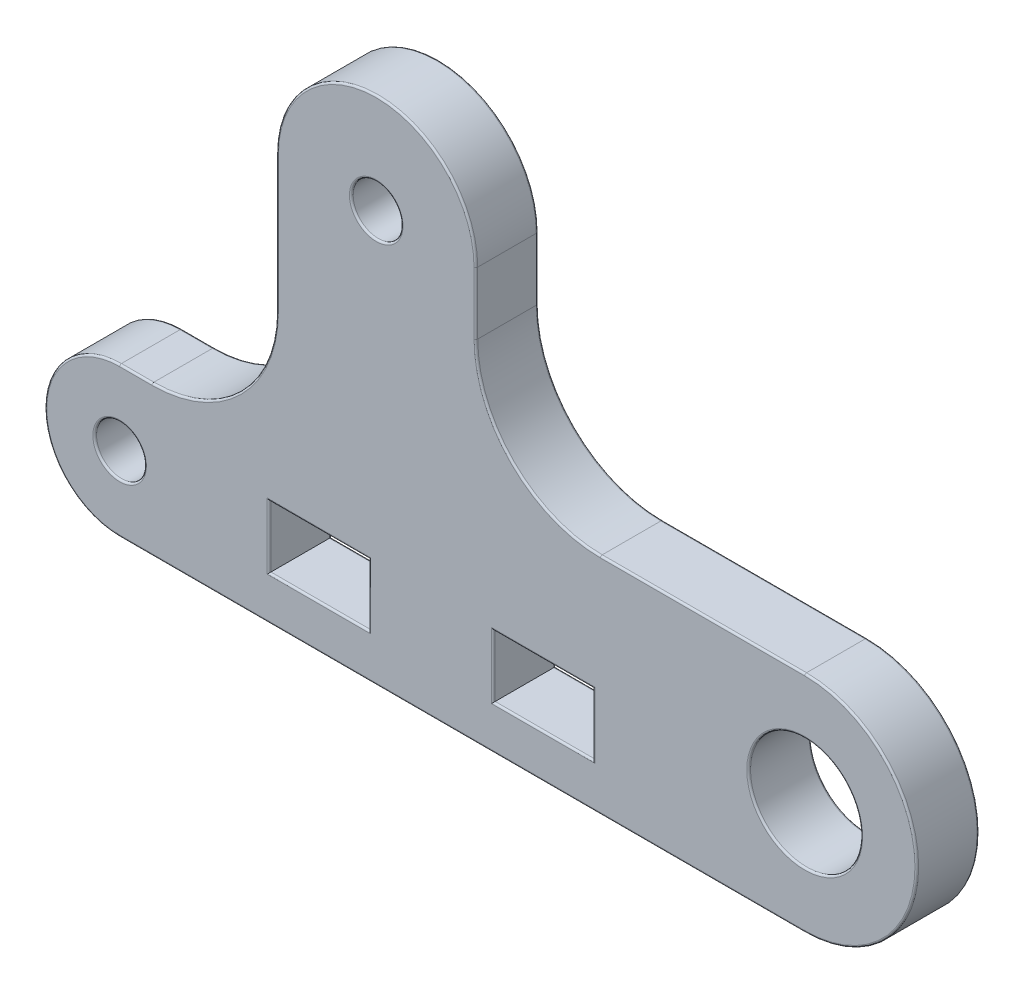
from build123d import *

# Parameters (mm, degrees)
SKETCH_1_R      = 4.5
SKETCH_1_R_2    = 2
SKETCH_1_W      = 8
SKETCH_1_H      = 5
EXTRUDE_1_DEPTH = 2.5
FILLET_1_R      = 0.15


with BuildPart() as part:
    # 草图1 → 凸台-拉伸1 (new, symmetric)
    with BuildSketch(Plane.XY):
        with BuildLine():
            Line((-27.5, 0), (27.5, 0))
            ThreePointArc((27.5, 0), (36.5, 9), (27.5, 18))
            Line((27.5, 18), (11.1, 18))
            ThreePointArc((11.1, 18), (4.028932188, 20.928932188), (1.1, 28))
            Line((1.1, 28), (1.1, 33))
            ThreePointArc((1.1, 33), (-6.9, 41), (-14.9, 33))
            Line((-14.9, 33), (-14.9, 22))
            ThreePointArc((-14.9, 22), (-17.828932188, 14.928932188), (-24.9, 12))
            Line((-24.9, 12), (-27.5, 12))
            ThreePointArc((-27.5, 12), (-33.5, 6), (-27.5, 0))
        make_face()
        with Locations((27.5, 9)):
            Circle(SKETCH_1_R, mode=Mode.SUBTRACT)
        with Locations((-27.5, 6)):
            Circle(SKETCH_1_R_2, mode=Mode.SUBTRACT)
        with Locations((-6.9, 33)):
            Circle(SKETCH_1_R_2, mode=Mode.SUBTRACT)
        with Locations((-11.5, 6)):
            Rectangle(SKETCH_1_W, SKETCH_1_H, mode=Mode.SUBTRACT)
        with Locations((6.5, 6)):
            Rectangle(SKETCH_1_W, SKETCH_1_H, mode=Mode.SUBTRACT)
    extrude(amount=EXTRUDE_1_DEPTH, both=True)

    # 圆角1
    fillet_1_edges = [part.edges().sort_by_distance(p)[0] for p in [
        (-26.2, 12, -2.5),
        (-17.828932188, 14.928932188, -2.5),
        (-14.9, 27.5, -2.5),
        (-6.9, 41, -2.5),
        (1.1, 30.5, -2.5),
        (4.028932188, 20.928932188, -2.5),
        (19.3, 18, -2.5),
        (36.5, 9, 2.5),
        (36.5, 9, -2.5),
        (0, 0, -2.5),
        (-33.5, 6, -2.5),
        (19.3, 18, 2.5),
        (4.028932188, 20.928932188, 2.5),
        (1.1, 30.5, 2.5),
        (23, 9, -2.5),
        (23, 9, 2.5),
        (-6.9, 41, 2.5),
        (-29.5, 6, -2.5),
        (-29.5, 6, 2.5),
        (-14.9, 27.5, 2.5),
        (-8.9, 33, -2.5),
        (-8.9, 33, 2.5),
        (-17.828932188, 14.928932188, 2.5),
        (-15.5, 6, -2.5),
        (-11.5, 3.5, -2.5),
        (-26.2, 12, 2.5),
        (-7.5, 6, -2.5),
        (-11.5, 8.5, -2.5),
        (-15.5, 6, 2.5),
        (-11.5, 3.5, 2.5),
        (-7.5, 6, 2.5),
        (-11.5, 8.5, 2.5),
        (-33.5, 6, 2.5),
        (2.5, 6, -2.5),
        (6.5, 3.5, -2.5),
        (10.5, 6, -2.5),
        (6.5, 8.5, -2.5),
        (2.5, 6, 2.5),
        (6.5, 3.5, 2.5),
        (10.5, 6, 2.5),
        (6.5, 8.5, 2.5),
        (0, 0, 2.5),
    ]]
    fillet(fillet_1_edges, radius=FILLET_1_R)


solid = part.part
